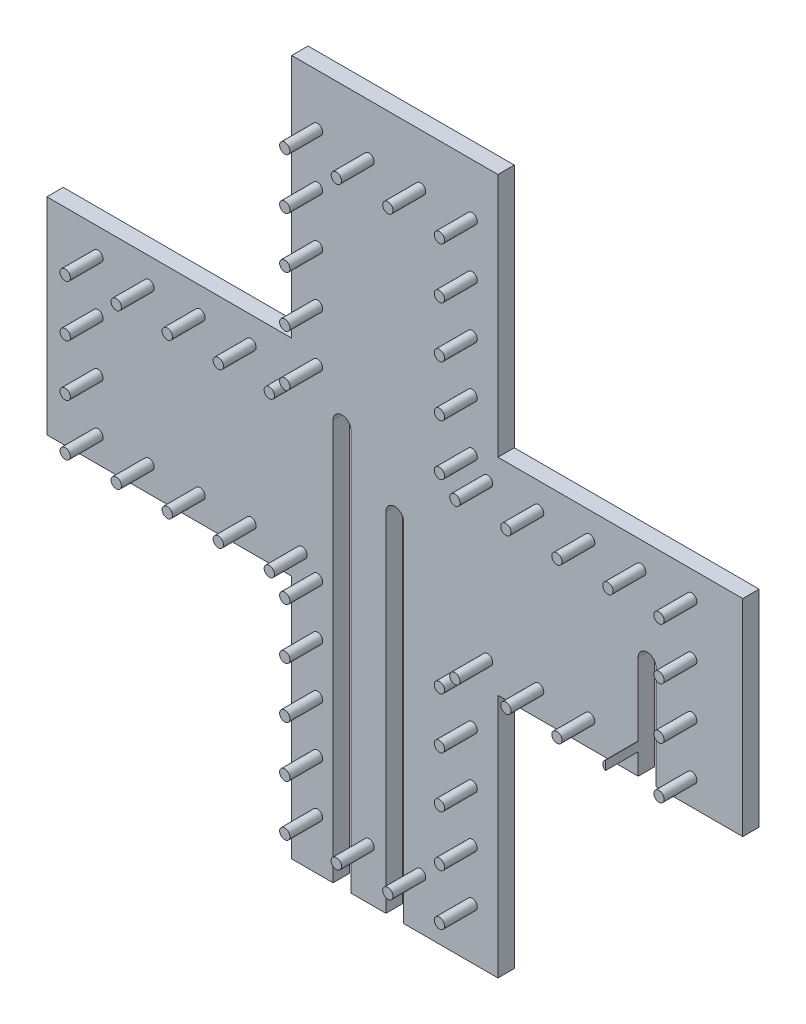
from build123d import *

# Parameters (mm, degrees)
SKETCH2_R               = 1.725
BOSS_EXTRUDE1_DEPTH     = 3.175
BOSS_EXTRUDE2_START     = 3.175
SKETCH2_3_R             = 1
BOSS_EXTRUDE2_DEPTH     = 6.35
CUT_EXTRUDE3_DEPTH      = 96.933443725
CUT_EXTRUDE3_DEPTH_BACK = 96.933443725


with BuildPart() as part:
    # Sketch2 → Boss-Extrude1 (new body)
    with BuildSketch(Plane.XY):
        Polygon((20, 20), (20, 67.5), (-20, 67.5), (-20, 20), (-67.5, 20), (-67.5, -20), (-20, -20), (-20, -67.5), (20, -67.5), (20, -20), (67.5, -20), (67.5, 20), align=None)
        with Locations((-10.253048327, 10.253048327)):
            Circle(SKETCH2_R, mode=Mode.SUBTRACT)
        Circle(SKETCH2_R, mode=Mode.SUBTRACT)
        with Locations((48.94, 0)):
            Circle(SKETCH2_R, mode=Mode.SUBTRACT)
        with Locations((-10.253048327, -10.253048327)):
            Circle(SKETCH2_R, mode=Mode.SUBTRACT)
    extrude(amount=BOSS_EXTRUDE1_DEPTH)

    # Sketch2<3> → Boss-Extrude2 (add)
    with BuildSketch(Plane.XY.offset(BOSS_EXTRUDE2_START)):
        with Locations((15, -57.6)):
            Circle(SKETCH2_3_R)
        with Locations((5, -57.6)):
            Circle(SKETCH2_3_R)
        with Locations((-5, -57.6)):
            Circle(SKETCH2_3_R)
        with Locations((-15, -57.6)):
            Circle(SKETCH2_3_R)
        with Locations((-15, -47.7)):
            Circle(SKETCH2_3_R)
        with Locations((-15, -37.8)):
            Circle(SKETCH2_3_R)
        with Locations((15, -37.8)):
            Circle(SKETCH2_3_R)
        with Locations((15, -47.7)):
            Circle(SKETCH2_3_R)
        with Locations((-15, -27.9)):
            Circle(SKETCH2_3_R)
        with Locations((15, -27.9)):
            Circle(SKETCH2_3_R)
        with Locations((-15, -18)):
            Circle(SKETCH2_3_R)
        with Locations((-18, -15)):
            Circle(SKETCH2_3_R)
        with Locations((-27.9, -15)):
            Circle(SKETCH2_3_R)
        with Locations((-37.8, -15)):
            Circle(SKETCH2_3_R)
        with Locations((-47.7, -15)):
            Circle(SKETCH2_3_R)
        with Locations((-57.6, -15)):
            Circle(SKETCH2_3_R)
        with Locations((-57.6, -5)):
            Circle(SKETCH2_3_R)
        with Locations((-57.6, 5)):
            Circle(SKETCH2_3_R)
        with Locations((-57.6, 15)):
            Circle(SKETCH2_3_R)
        with Locations((-47.7, 15)):
            Circle(SKETCH2_3_R)
        with Locations((-27.9, 15)):
            Circle(SKETCH2_3_R)
        with Locations((-18, 15)):
            Circle(SKETCH2_3_R)
        with Locations((-15, 18)):
            Circle(SKETCH2_3_R)
        with Locations((-15, 27.9)):
            Circle(SKETCH2_3_R)
        with Locations((-15, 37.8)):
            Circle(SKETCH2_3_R)
        with Locations((-15, 47.7)):
            Circle(SKETCH2_3_R)
        with Locations((-15, 57.6)):
            Circle(SKETCH2_3_R)
        with Locations((-5, 57.6)):
            Circle(SKETCH2_3_R)
        with Locations((5, 57.6)):
            Circle(SKETCH2_3_R)
        with Locations((15, 57.6)):
            Circle(SKETCH2_3_R)
        with Locations((15, 47.7)):
            Circle(SKETCH2_3_R)
        with Locations((15, 27.9)):
            Circle(SKETCH2_3_R)
        with Locations((15, 37.8)):
            Circle(SKETCH2_3_R)
        with Locations((15, 18)):
            Circle(SKETCH2_3_R)
        with Locations((18, 15)):
            Circle(SKETCH2_3_R)
        with Locations((27.9, 15)):
            Circle(SKETCH2_3_R)
        with Locations((37.8, 15)):
            Circle(SKETCH2_3_R)
        with Locations((47.7, 15)):
            Circle(SKETCH2_3_R)
        with Locations((57.6, 15)):
            Circle(SKETCH2_3_R)
        with Locations((57.6, 5)):
            Circle(SKETCH2_3_R)
        with Locations((57.6, -5)):
            Circle(SKETCH2_3_R)
        with Locations((57.6, -15)):
            Circle(SKETCH2_3_R)
        with Locations((47.7, -15)):
            Circle(SKETCH2_3_R)
        with Locations((37.8, -15)):
            Circle(SKETCH2_3_R)
        with Locations((15, -18)):
            Circle(SKETCH2_3_R)
        with Locations((18, -15)):
            Circle(SKETCH2_3_R)
        with Locations((27.9, -15)):
            Circle(SKETCH2_3_R)
        with Locations((-37.8, 15)):
            Circle(SKETCH2_3_R)
    extrude(amount=BOSS_EXTRUDE2_DEPTH)

    # Sketch3 → Cut-Extrude3 (cut, two sides: drawn at the far end of the back side and taken through both)
    with BuildSketch(Plane.XY.offset(-CUT_EXTRUDE3_DEPTH_BACK)):
        with BuildLine():
            Line((47.215, 0), (47.215, -52.394008893))
            ThreePointArc((47.215, -52.394008893), (48.94, -54.119008893), (50.665, -52.394008893))
            Line((50.665, -52.394008893), (50.665, 0))
            ThreePointArc((50.665, 0), (48.94, 1.725), (47.215, 0))
        make_face()
        with BuildLine():
            Line((-1.725, 0), (-1.725, -86.710184275))
            ThreePointArc((-1.725, -86.710184275), (0, -88.435184275), (1.725, -86.710184275))
            Line((1.725, -86.710184275), (1.725, 0))
            ThreePointArc((1.725, 0), (0, 1.725), (-1.725, 0))
        make_face()
        with BuildLine():
            Line((-11.978048327, 10.253048327), (-11.978048327, -86.719835381))
            ThreePointArc((-11.978048327, -86.719835381), (-10.253048327, -88.444835381), (-8.528048327, -86.719835381))
            Line((-8.528048327, -86.719835381), (-8.528048327, 10.253048327))
            ThreePointArc((-8.528048327, 10.253048327), (-10.253048327, 11.978048327), (-11.978048327, 10.253048327))
        make_face()
    extrude(amount=CUT_EXTRUDE3_DEPTH + CUT_EXTRUDE3_DEPTH_BACK, mode=Mode.SUBTRACT)


solid = part.part
